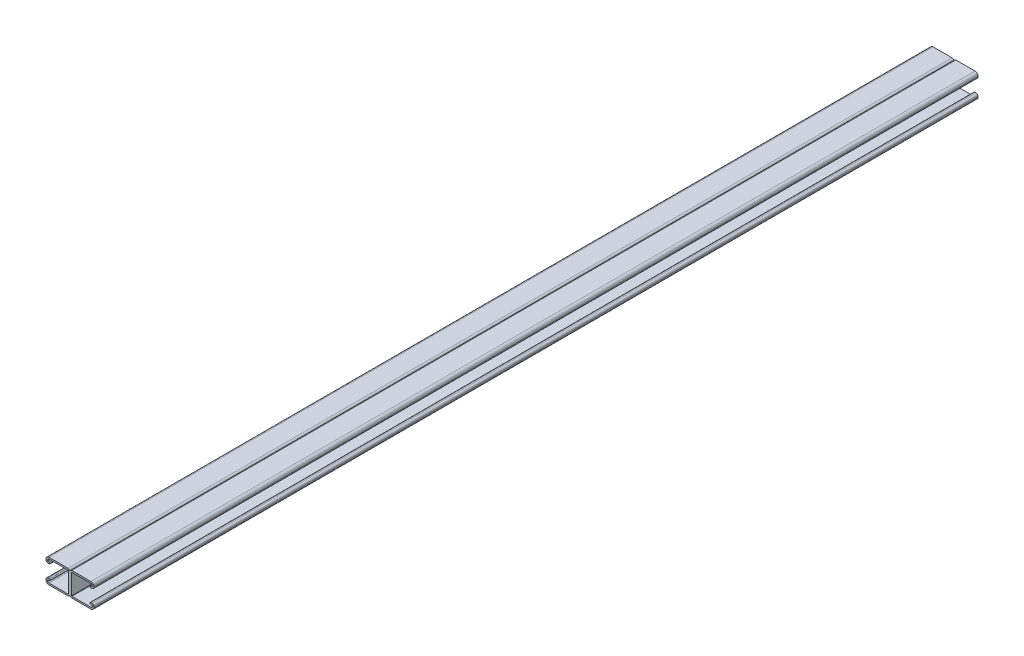
from build123d import *

# Parameters (mm, degrees)
BOSS_EXTRUDE1_DEPTH = 1524


with BuildPart() as part:
    # Sketch1 → Boss-Extrude1 (new body)
    with BuildSketch(Plane.XY):
        with BuildLine():
            Line((-36.22675, 20.6375), (-3.46075, 20.6375))
            ThreePointArc((-3.46075, 20.6375), (-1.013630207, 19.623869793), (0, 17.17675))
            Line((0, 17.17675), (0, -17.17675))
            ThreePointArc((0, -17.17675), (-1.013630207, -19.623869793), (-3.46075, -20.6375))
            Line((-3.46075, -20.6375), (-36.22675, -20.6375))
            ThreePointArc((-36.22675, -20.6375), (-39.796401808, -19.158901808), (-41.275, -15.58925))
            Line((-41.275, -15.58925), (-41.275, -14.57325))
            ThreePointArc((-41.275, -14.57325), (-40.261369793, -12.126130207), (-37.81425, -11.1125))
            Line((-37.81425, -11.1125), (-35.5346, -11.1125))
            ThreePointArc((-35.5346, -11.1125), (-34.1376, -12.5095), (-35.5346, -13.9065))
            Line((-35.5346, -13.9065), (-37.81425, -13.9065))
            ThreePointArc((-37.81425, -13.9065), (-38.285713446, -14.101786554), (-38.481, -14.57325))
            Line((-38.481, -14.57325), (-38.481, -15.58925))
            ThreePointArc((-38.481, -15.58925), (-37.820745461, -17.183245461), (-36.22675, -17.8435))
            Line((-36.22675, -17.8435), (-3.46075, -17.8435))
            ThreePointArc((-3.46075, -17.8435), (-2.989286554, -17.648213446), (-2.794, -17.17675))
            Line((-2.794, -17.17675), (-2.794, 17.17675))
            ThreePointArc((-2.794, 17.17675), (-2.989286554, 17.648213446), (-3.46075, 17.8435))
            Line((-3.46075, 17.8435), (-36.22675, 17.8435))
            ThreePointArc((-36.22675, 17.8435), (-37.820745461, 17.183245461), (-38.481, 15.58925))
            Line((-38.481, 15.58925), (-38.481, 14.57325))
            ThreePointArc((-38.481, 14.57325), (-38.285713446, 14.101786554), (-37.81425, 13.9065))
            Line((-37.81425, 13.9065), (-35.5346, 13.9065))
            ThreePointArc((-35.5346, 13.9065), (-34.1376, 12.5095), (-35.5346, 11.1125))
            Line((-35.5346, 11.1125), (-37.81425, 11.1125))
            ThreePointArc((-37.81425, 11.1125), (-40.261369793, 12.126130207), (-41.275, 14.57325))
            Line((-41.275, 14.57325), (-41.275, 15.58925))
            ThreePointArc((-41.275, 15.58925), (-39.796401808, 19.158901808), (-36.22675, 20.6375))
        make_face()
    extrude(amount=-BOSS_EXTRUDE1_DEPTH)


with BuildPart() as body_2:
    # Mirror1: mirrored copy
    add(part.part.mirror(Plane(origin=(0, 17.17675, -1524), x_dir=(0, 0, 1), z_dir=(1, 0, 0))))

    # Combine1: union part
    add(part.part)


solid = body_2.part
